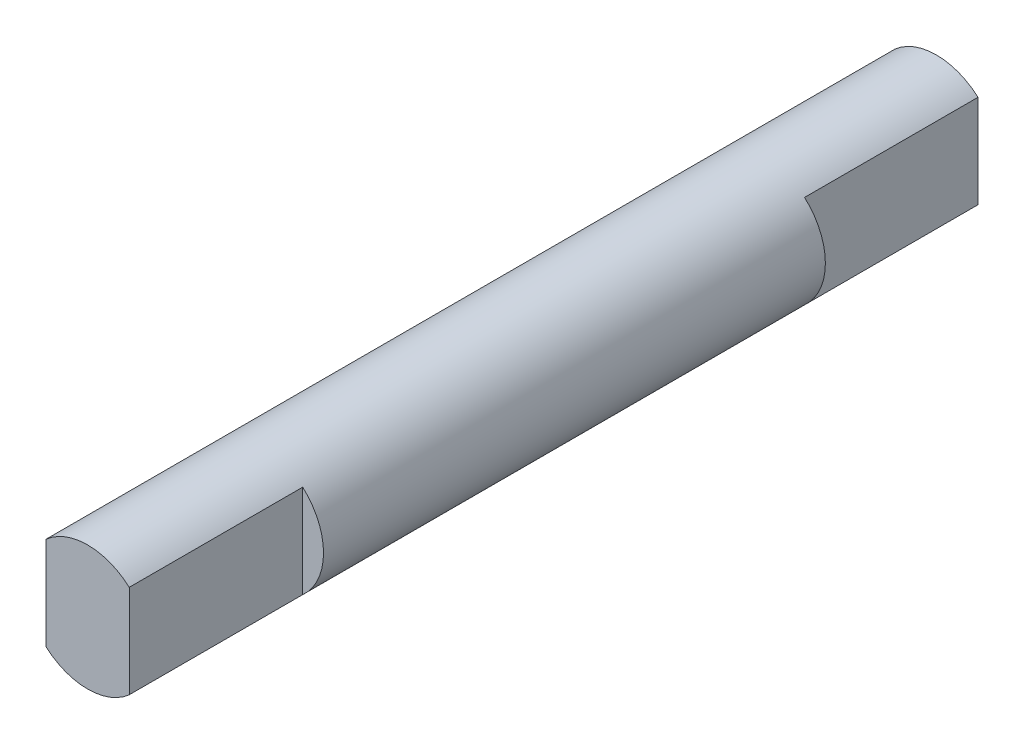
from build123d import *

# Parameters (mm, degrees)
CROQUIS1_R              = 2.7
SALIENTE_EXTRUIR1_DEPTH = 36.7
CORTAR_EXTRUIR1_DEPTH   = 7.5
CORTAR_EXTRUIR2_START   = -7.5
CORTAR_EXTRUIR2_DEPTH   = 7.5


with BuildPart() as part:
    # Croquis1 → Saliente-Extruir1 (new body)
    with BuildSketch(Plane.XY):
        Circle(CROQUIS1_R)
    extrude(amount=SALIENTE_EXTRUIR1_DEPTH)

    # Croquis2 → Cortar-Extruir1 (cut)
    with BuildSketch(Plane(origin=(0, 0, 0), x_dir=(-1, 0, 0), z_dir=(0, 0, -1))):
        with BuildLine():
            ThreePointArc((-1.8, 2.01246118), (-2.7, 0), (-1.8, -2.01246118))
            Line((-1.8, -2.01246118), (-1.8, 2.01246118))
        make_face()
        with BuildLine():
            Line((1.8, 2.01246118), (1.8, -2.01246118))
            ThreePointArc((1.8, -2.01246118), (2.464751509, -1.102270384), (2.7, 0))
            ThreePointArc((2.7, 0), (2.464751509, 1.102270384), (1.8, 2.01246118))
        make_face()
    extrude(amount=-CORTAR_EXTRUIR1_DEPTH, mode=Mode.SUBTRACT)

    # Croquis3 → Cortar-Extruir2 (cut)
    with BuildSketch(Plane.XY.offset(36.7).offset(CORTAR_EXTRUIR2_START)):
        with BuildLine():
            Line((1.8, 2.01246118), (1.8, -2.01246118))
            ThreePointArc((1.8, -2.01246118), (2.464751509, -1.102270384), (2.7, 0))
            ThreePointArc((2.7, 0), (2.464751509, 1.102270384), (1.8, 2.01246118))
        make_face()
        with BuildLine():
            ThreePointArc((-1.8, 2.01246118), (-2.7, 0), (-1.8, -2.01246118))
            Line((-1.8, -2.01246118), (-1.8, 2.01246118))
        make_face()
    extrude(amount=CORTAR_EXTRUIR2_DEPTH, mode=Mode.SUBTRACT)


solid = part.part
